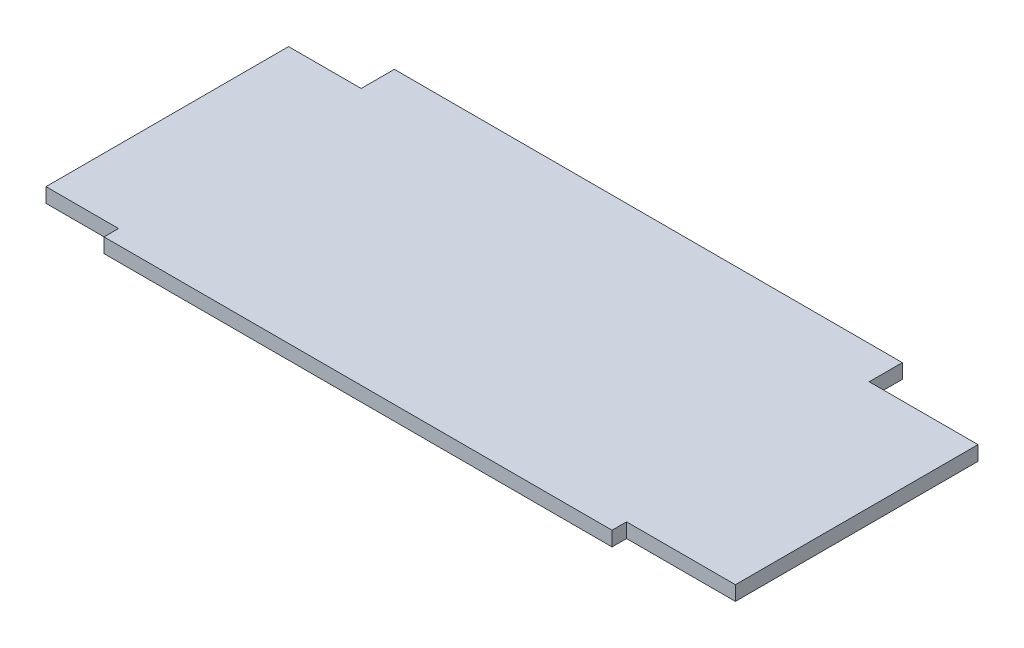
from build123d import *

# Parameters (mm, degrees)
ESTRUSIONE_ESTRUSIONE1_DEPTH      = 35.42788
ESTRUSIONE_ESTRUSIONE1_DEPTH_BACK = 4.57212
SCHIZZO1_W                        = 70
SCHIZZO1_H                        = 2
SCHIZZO2_W                        = 33.42788034
SCHIZZO2_H                        = 2
ESTRUSIONE_ESTRUSIONE2_DEPTH      = 15
SCHIZZO3_W                        = 33.42788034
SCHIZZO3_H                        = 2
ESTRUSIONE_ESTRUSIONE3_DEPTH      = 10


with BuildPart() as part:
    # Schizzo1 → Estrusione-Estrusione1 (new, two sides: drawn at the far end of the back side and taken through both)
    with BuildSketch(Plane.XY.offset(-ESTRUSIONE_ESTRUSIONE1_DEPTH_BACK)):
        with Locations((113, -73.5)):
            Rectangle(SCHIZZO1_W, SCHIZZO1_H)
    extrude(amount=ESTRUSIONE_ESTRUSIONE1_DEPTH + ESTRUSIONE_ESTRUSIONE1_DEPTH_BACK)

    # Schizzo2 → Estrusione-Estrusione2 (add)
    with BuildSketch(Plane(origin=(148, 0, 0), x_dir=(0, 0, -1), z_dir=(1, 0, 0))):
        with Locations((-16.71394017, -73.5)):
            Rectangle(SCHIZZO2_W, SCHIZZO2_H)
    extrude(amount=ESTRUSIONE_ESTRUSIONE2_DEPTH)

    # Schizzo3 → Estrusione-Estrusione3 (add)
    with BuildSketch(Plane.ZY.offset(-78)):
        with Locations((16.71394017, -73.5)):
            Rectangle(SCHIZZO3_W, SCHIZZO3_H)
    extrude(amount=ESTRUSIONE_ESTRUSIONE3_DEPTH)


solid = part.part
